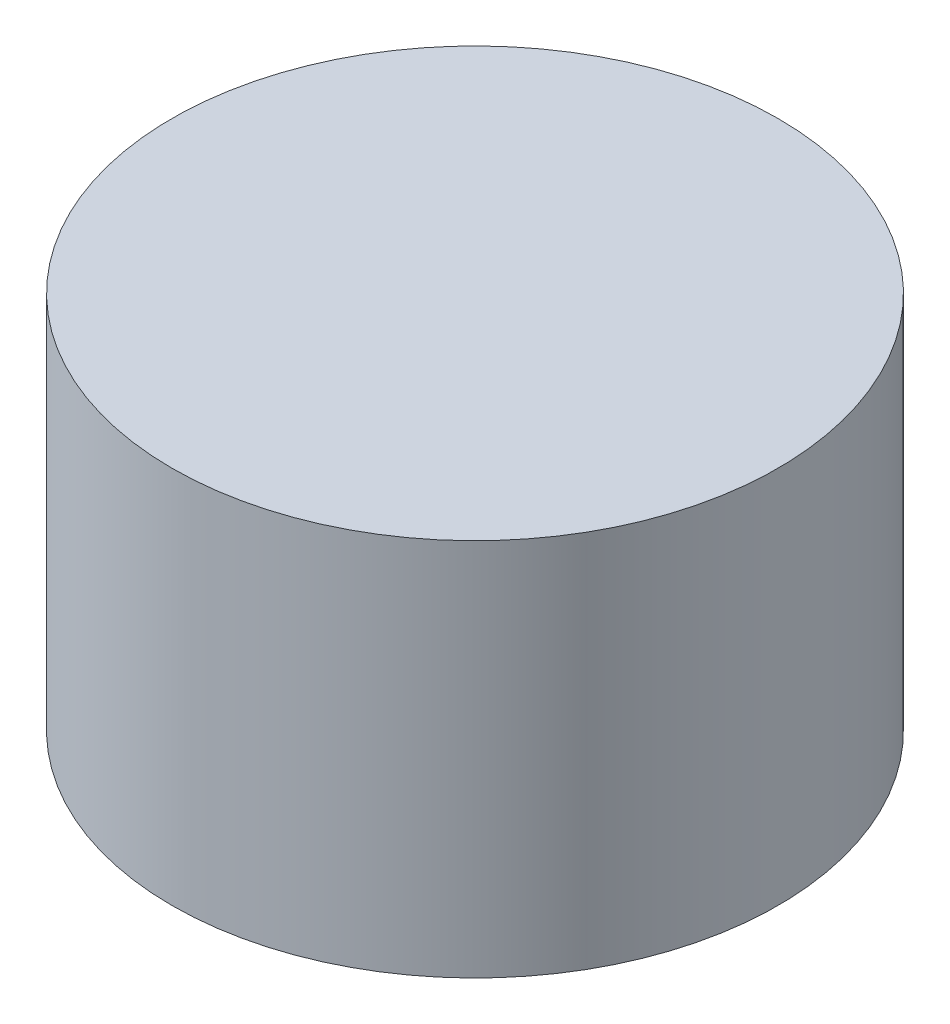
from build123d import *

# Parameters (mm, degrees)
SKETCH1_R           = 20.32
BOSS_EXTRUDE1_DEPTH = 25.4


with BuildPart() as part:
    # Sketch1 → Boss-Extrude1 (new body)
    with BuildSketch(Plane(origin=(0, 0, 0), x_dir=(1, 0, 0), z_dir=(0, 1, 0))):
        with Locations(Location((0, 0, 0), (0, 0, 270))):
            Circle(SKETCH1_R)
    extrude(amount=BOSS_EXTRUDE1_DEPTH)


solid = part.part
